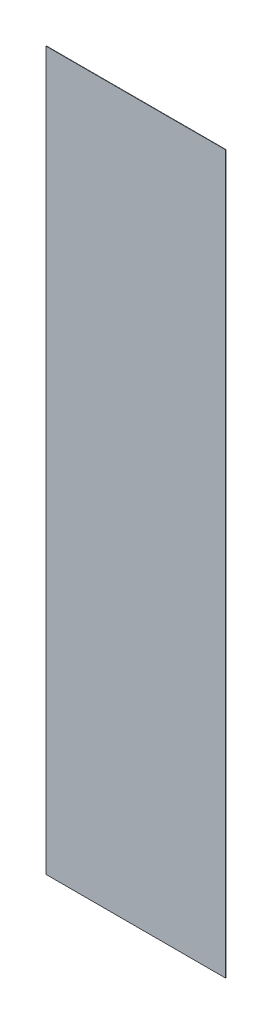
from build123d import *

# Parameters (mm, degrees)
SKETCH1_W           = 6.35
SKETCH1_H           = 25.4254
BOSS_EXTRUDE1_DEPTH = 0.0127


with BuildPart() as part:
    # Sketch1 → Boss-Extrude1 (new body)
    with BuildSketch(Plane.XY):
        Rectangle(SKETCH1_W, SKETCH1_H)
    extrude(amount=BOSS_EXTRUDE1_DEPTH)


solid = part.part
